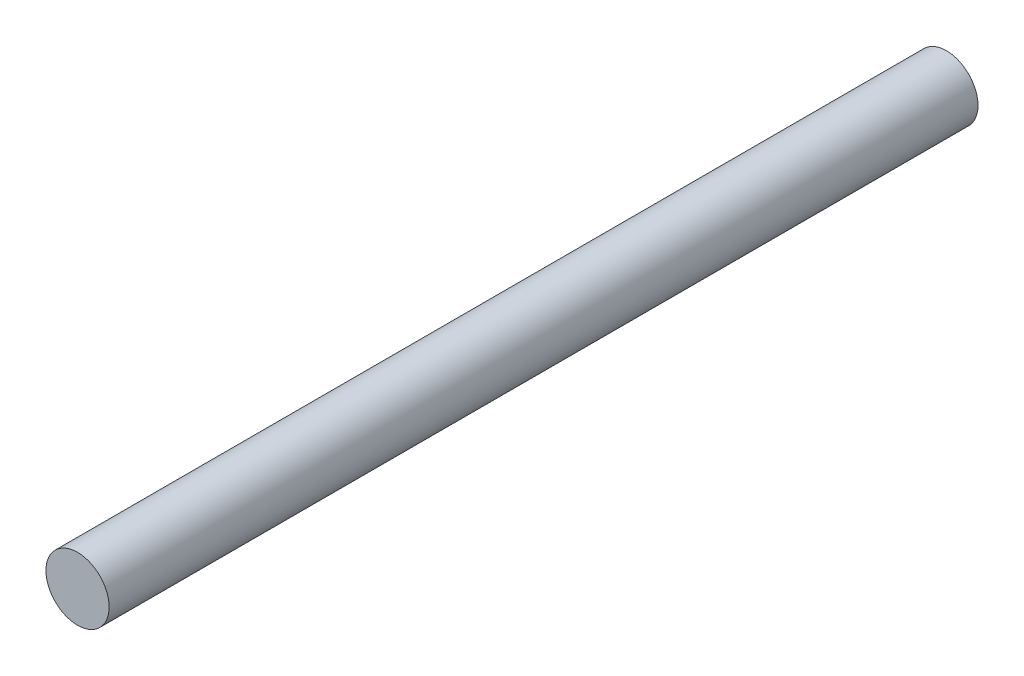
from build123d import *

# Parameters (mm, degrees)
ESQUISSE1_R        = 0.6
BOSS_EXTRU_1_DEPTH = 16.5


with BuildPart() as part:
    # Esquisse1 → Boss.-Extru.1 (new body)
    with BuildSketch(Plane.XY):
        Circle(ESQUISSE1_R)
    extrude(amount=BOSS_EXTRU_1_DEPTH)


solid = part.part
